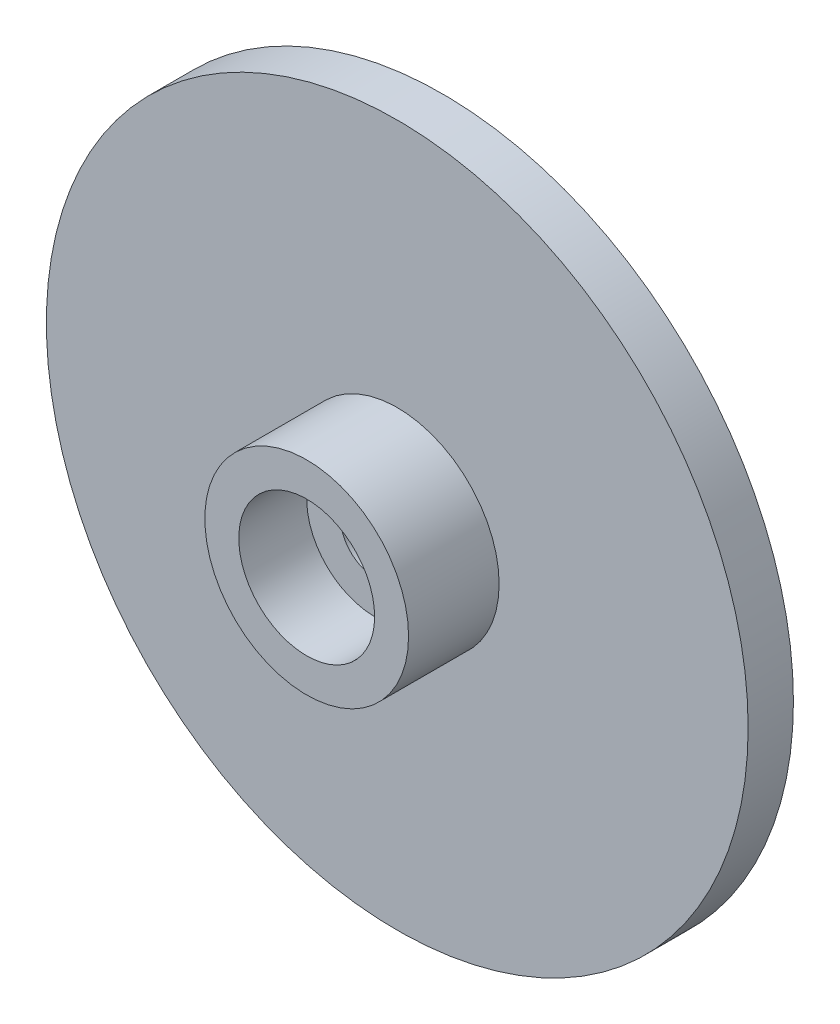
from build123d import *

# Parameters (mm, degrees)
SCHIZZO1_R                   = 15.5
ESTRUSIONE_ESTRUSIONE1_DEPTH = 2
SCHIZZO2_R                   = 4.5
SCHIZZO2_R_2                 = 3
ESTRUSIONE_ESTRUSIONE2_DEPTH = 4
SCHIZZO3_R                   = 3
ESTRUSIONE_ESTRUSIONE3_DEPTH = 1
SCHIZZO4_R                   = 4.5
SCHIZZO4_R_2                 = 3.5
SCHIZZO4_R_3                 = 3
TAGLIO_ESTRUSIONE1_DEPTH     = 1
SCHIZZO5_R                   = 1.5
TAGLIO_ESTRUSIONE2_DEPTH     = 12


with BuildPart() as part:
    # Schizzo1 → Estrusione-Estrusione1 (new body)
    with BuildSketch(Plane.XY):
        Circle(SCHIZZO1_R)
    extrude(amount=ESTRUSIONE_ESTRUSIONE1_DEPTH)

    # Schizzo2 → Estrusione-Estrusione2 (add)
    with BuildSketch(Plane.XY.offset(2)):
        Circle(SCHIZZO2_R)
        Circle(SCHIZZO2_R_2, mode=Mode.SUBTRACT)
    extrude(amount=ESTRUSIONE_ESTRUSIONE2_DEPTH)

    # Schizzo3 → Estrusione-Estrusione3 (add)
    with BuildSketch(Plane.XY.offset(2)):
        Circle(SCHIZZO3_R)
    extrude(amount=ESTRUSIONE_ESTRUSIONE3_DEPTH)

    # Schizzo4 → Taglio-Estrusione1 (cut)
    # profile 1 of 2: a face of its own
    with BuildSketch(Plane(origin=(0, 0, 0), x_dir=(-1, 0, 0), z_dir=(0, 0, -1))):
        with Locations(Location((0, 0, 0), (0, 0, 180))):
            Circle(SCHIZZO4_R)
        Circle(SCHIZZO4_R_2, mode=Mode.SUBTRACT)
    # profile 2 of 2: a face of its own
    with BuildSketch(Plane(origin=(0, 0, 0), x_dir=(-1, 0, 0), z_dir=(0, 0, -1))):
        with Locations(Location((0, 0, 0), (0, 0, 180))):
            Circle(SCHIZZO4_R_3)
    extrude(amount=-TAGLIO_ESTRUSIONE1_DEPTH, mode=Mode.SUBTRACT)

    # Schizzo5 → Taglio-Estrusione2 (cut)
    with BuildSketch(Plane(origin=(0, 0, 1), x_dir=(-1, 0, 0), z_dir=(0, 0, -1))):
        Circle(SCHIZZO5_R)
    extrude(amount=-TAGLIO_ESTRUSIONE2_DEPTH, mode=Mode.SUBTRACT)


solid = part.part
